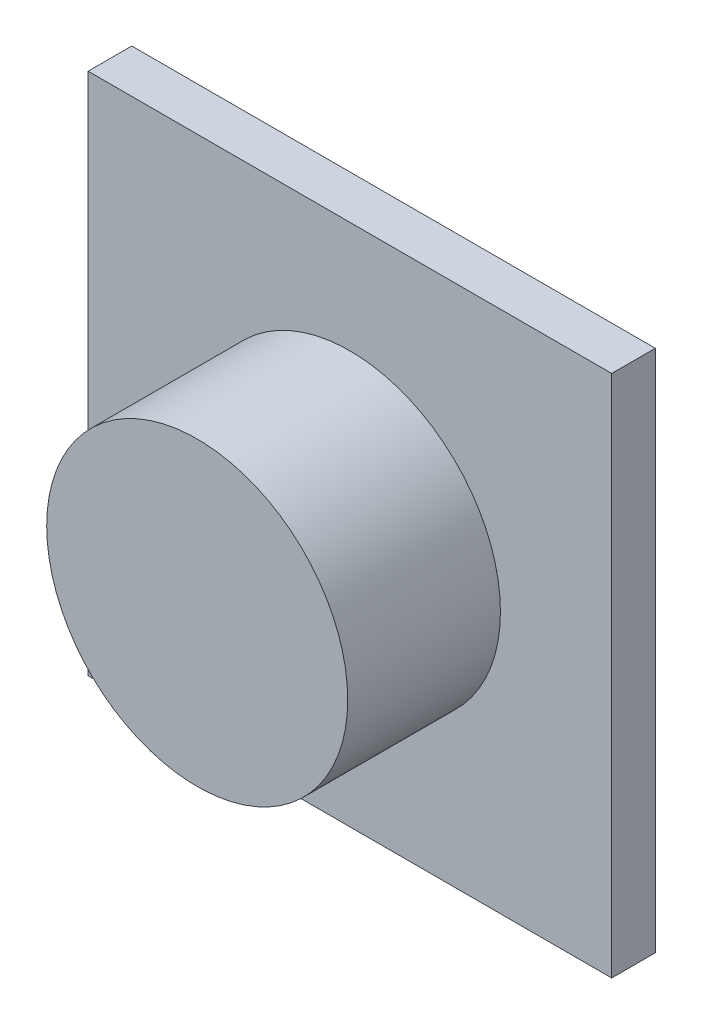
from build123d import *

# Parameters (mm, degrees)
SKETCH1_W           = 12
SKETCH1_H           = 12
BOSS_EXTRUDE1_DEPTH = 1
SKETCH2_R           = 3.45
BOSS_EXTRUDE2_DEPTH = 3.5


with BuildPart() as part:
    # Sketch1 → Boss-Extrude1 (new body)
    with BuildSketch(Plane.XY):
        with Locations((-4.342560554, 0.163321799)):
            Rectangle(SKETCH1_W, SKETCH1_H)
    extrude(amount=BOSS_EXTRUDE1_DEPTH)

    # Sketch2 → Boss-Extrude2 (add)
    with BuildSketch(Plane.XY.offset(1)):
        with Locations((-4.342560554, 0.163321799)):
            Circle(SKETCH2_R)
    extrude(amount=BOSS_EXTRUDE2_DEPTH)


solid = part.part
